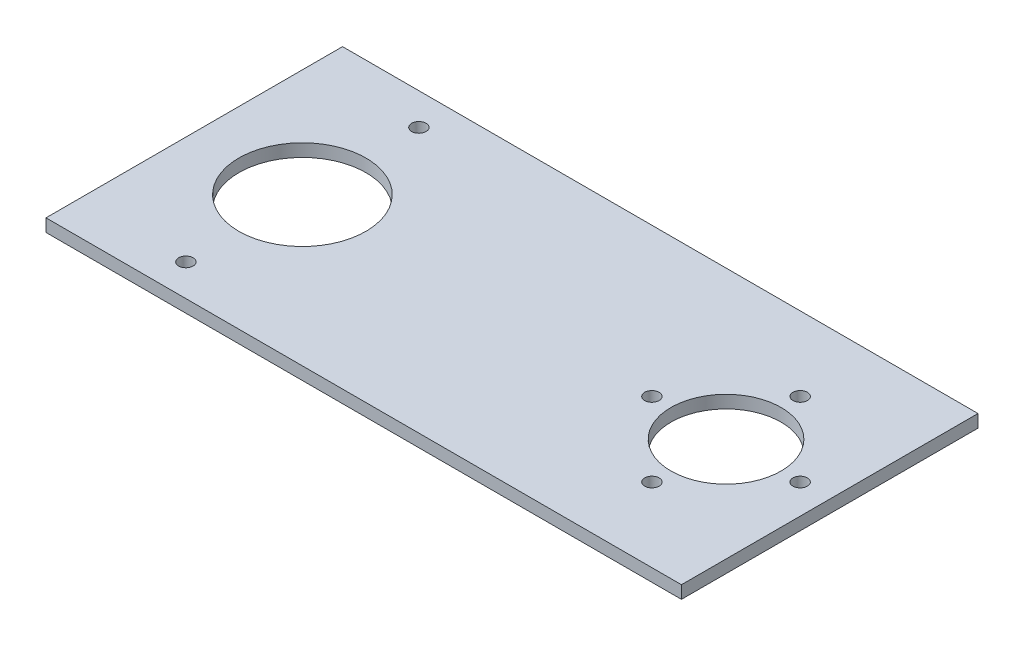
from build123d import *

# Parameters (mm, degrees)
SKETCH1_W            = 150
SKETCH1_H            = 70
BOSS_EXTRUDE1_DEPTH  = 3
SKETCH2_R            = 15
SKETCH2_R_2          = 13
CUT_EXTRUDE1_DEPTH   = 166.556636835
M3_CLEARANCE_HOLE1_D = 3.4


with BuildPart() as part:
    # Sketch1 → Boss-Extrude1 (new body)
    with BuildSketch(Plane(origin=(0, 0, 0), x_dir=(1, 0, 0), z_dir=(0, 1, 0))):
        with Locations((75, 35)):
            Rectangle(SKETCH1_W, SKETCH1_H)
    extrude(amount=BOSS_EXTRUDE1_DEPTH)

    # Sketch2 → Cut-Extrude1 (cut, through all)
    with BuildSketch(Plane(origin=(0, 3, 0), x_dir=(1, 0, 0), z_dir=(0, 1, 0))):
        with Locations(Location((25.522198067, 35, 0), (0, 0, 270))):
            Circle(SKETCH2_R)
        with Locations(Location((125.522198067, 35, 0), (0, 0, 270))):
            Circle(SKETCH2_R_2)
    extrude(amount=-CUT_EXTRUDE1_DEPTH, mode=Mode.SUBTRACT)

    # M3 Clearance Hole1 (through all)
    with Locations(Plane(origin=(0, 3, 0), x_dir=(1, 0, 0), z_dir=(0, 1, 0))):
        with Locations((25.522198067, 62.5), (25.522198067, 7.5), (108.022198067, 35), (125.522198067, 52.5), (143.022198067, 35), (125.522198067, 17.5)):
            Hole(M3_CLEARANCE_HOLE1_D / 2)


solid = part.part
